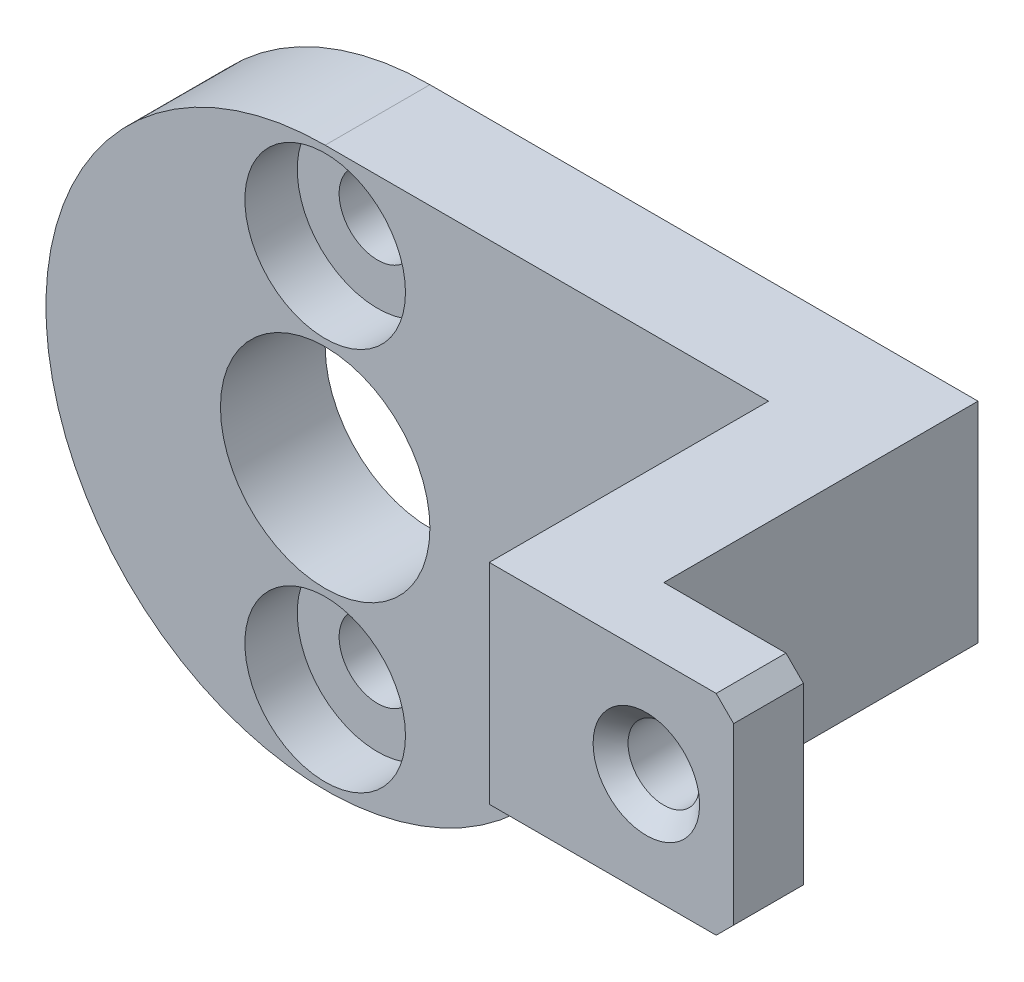
from build123d import *

# Parameters (mm, degrees)
SKETCH_1_W                = 14.3
SKETCH_1_H                = 16
EXTRUDE_1_DEPTH           = 1
SKETCH_3_R                = 3
CUT_EXTRUDE_3_DEPTH       = 10
SKETCH_4_R                = 1.25
CUT_EXTRUDE_4_DEPTH       = 2
CHAMFER_2_SIZE            = 3
SKETCH1_W                 = 2
SKETCH1_H                 = 16
EXTRUDE1_DEPTH            = 8
SKETCH2_W                 = 2
SKETCH2_H                 = 16
EXTRUDE2_DEPTH            = 10
SKETCH3_W                 = 14.3
SKETCH3_H                 = 10
EXTRUDE3_DEPTH            = 10
HOLE_WIZARD_M2_5_2_D      = 2.05
HOLE_WIZARD_M2_5_2_DEPTH  = 7.25
HOLE_WIZARD_M2_5_2_TIP    = 0.615882135
CHAMFER1_SIZE             = 3
CHAMFER4_SIZE             = 0.5
EXTRUDE4_DEPTH            = 6
SKETCH7_W                 = 2
SKETCH7_H                 = 6
EXTRUDE5_DEPTH            = 10
CHAMFER5_SIZE             = 0.5
EXTRUDE6_START            = -2
SKETCH8_W                 = 16
SKETCH8_H                 = 16
SKETCH8_R                 = 3
EXTRUDE6_DEPTH            = 2
SKETCH9_R                 = 1.1
EXTRUDE7_DEPTH            = 21.545619971
SKETCH12_W                = 6
SKETCH12_H                = 6
EXTRUDE10_DEPTH           = 0.5
SKETCH13_W                = 8
SKETCH13_H                = 6
EXTRUDE11_DEPTH           = 0.5
SKETCH15_R                = 1.1
SKETCH15_R_2              = 3
EXTRUDE13_DEPTH           = 1
CUT_EXTRUDE_1_DEPTH       = 10
HOLE_WIZARD_1_D           = 2.2
HOLE_WIZARD_1_CBORE_D     = 4.6
HOLE_WIZARD_1_CBORE_DEPTH = 1.5
FILLET_3_R                = 1
SKETCH_12_W               = 8.120884579
SKETCH_12_H               = 6.489865184
CUT_EXTRUDE_2_DEPTH       = 10


with BuildPart() as part:
    # 草图1 → 拉伸1 (new, symmetric)
    with BuildSketch(Plane.XY):
        Rectangle(SKETCH_1_W, SKETCH_1_H)
    extrude(amount=EXTRUDE_1_DEPTH, both=True)

    # 草图3 → 拉伸3 (cut)
    with BuildSketch(Plane(origin=(0, 0, -1), x_dir=(-1, 0, 0), z_dir=(0, 0, -1))):
        with Locations((2.55, 0)):
            Circle(SKETCH_3_R)
    extrude(amount=-CUT_EXTRUDE_3_DEPTH, mode=Mode.SUBTRACT)

    # 草图4 → 拉伸4 (cut)
    with BuildSketch(Plane(origin=(0, 0, -1), x_dir=(-1, 0, 0), z_dir=(0, 0, -1))):
        with Locations((2.55, 5)):
            Circle(SKETCH_4_R)
        with Locations((2.55, -5)):
            Circle(SKETCH_4_R)
    extrude(amount=-CUT_EXTRUDE_4_DEPTH, mode=Mode.SUBTRACT)

    # 倒角2
    chamfer_2_edges = [part.edges().sort_by_distance(p)[0] for p in [
        (-7.15, 8, 0),
        (-7.15, -8, 0),
    ]]
    chamfer(chamfer_2_edges, length=CHAMFER_2_SIZE)

    # Sketch1 → Extrude1 (add)
    with BuildSketch(Plane.XY.offset(1)):
        with Locations((6.15, 0)):
            Rectangle(SKETCH1_W, SKETCH1_H)
    extrude(amount=EXTRUDE1_DEPTH)

    # Sketch2 → Extrude2 (add)
    with BuildSketch(Plane(origin=(7.15, 0, 0), x_dir=(0, 0, -1), z_dir=(1, 0, 0))):
        with Locations((-8, 0)):
            Rectangle(SKETCH2_W, SKETCH2_H)
    extrude(amount=EXTRUDE2_DEPTH)

    # Sketch3 → Extrude3 (cut)
    with BuildSketch(Plane.XZ.offset(8)):
        with Locations((10, 4)):
            Rectangle(SKETCH3_W, SKETCH3_H)
    extrude(amount=-EXTRUDE3_DEPTH, mode=Mode.SUBTRACT)

    # M2.5 螺纹孔2
    with Locations(Plane(origin=(14.65, 5, 9), x_dir=(1, 0, 0), z_dir=(0, 0, 1))):
        with Locations((0, 0)):
            Hole(HOLE_WIZARD_M2_5_2_D / 2, depth=HOLE_WIZARD_M2_5_2_DEPTH)
            with Locations((0, 0, -(HOLE_WIZARD_M2_5_2_DEPTH + HOLE_WIZARD_M2_5_2_TIP / 2))):  # 118° drill point
                Cone(0, HOLE_WIZARD_M2_5_2_D / 2, HOLE_WIZARD_M2_5_2_TIP, mode=Mode.SUBTRACT)

    # Chamfer1
    chamfer1_edges = [part.edges().sort_by_distance(p)[0] for p in [
        (2.85, -8, 0),
    ]]
    chamfer(chamfer1_edges, length=CHAMFER1_SIZE)

    # Chamfer4
    chamfer4_edges = [part.edges().sort_by_distance(p)[0] for p in [
        (15.675, 5, 9),
    ]]
    chamfer(chamfer4_edges, length=CHAMFER4_SIZE)

    # Sketch6 → Extrude4 (add)
    with BuildSketch(Plane(origin=(0, 8, 0), x_dir=(-1, 0, 0), z_dir=(0, 1, 0))):
        Polygon((-10.65, 7), (-12.65, 7), (-12.65, -1), (-7.15, -1), (-5.15, 1), (-10.65, 1), align=None)
    extrude(amount=-EXTRUDE4_DEPTH)

    # Sketch7 → Extrude5 (cut)
    with BuildSketch(Plane.XZ.offset(-2)):
        with Locations((6.15, 4)):
            Rectangle(SKETCH7_W, SKETCH7_H)
    extrude(amount=-EXTRUDE5_DEPTH, mode=Mode.SUBTRACT)

    # Chamfer5
    chamfer5_edges = [part.edges().sort_by_distance(p)[0] for p in [
        (17.15, 8, 8),
        (17.15, 2, 8),
        (5.15, 2, 8),
        (5.15, 8, 8),
    ]]
    chamfer(chamfer5_edges, length=CHAMFER5_SIZE)

    # Sketch8 → Extrude6 (add)
    with BuildSketch(Plane.XY.offset(1).offset(EXTRUDE6_START)):
        with Locations((-2.55, 0)):
            Rectangle(SKETCH8_W, SKETCH8_H)
        with Locations(Location((-2.55, 0, 0), (0, 0, 180))):
            Circle(SKETCH8_R, mode=Mode.SUBTRACT)
    extrude(amount=EXTRUDE6_DEPTH)

    # Sketch9 → Extrude7 (cut, through all)
    with BuildSketch(Plane.XY.offset(1)):
        with Locations((-2.55, -5.5)):
            Circle(SKETCH9_R)
        with Locations((-2.55, 5.5)):
            Circle(SKETCH9_R)
    extrude(amount=-EXTRUDE7_DEPTH, mode=Mode.SUBTRACT)

    # Sketch12 → Extrude10 (add)
    with BuildSketch(Plane.ZY.offset(-10.65)):
        with Locations((4, 5)):
            Rectangle(SKETCH12_W, SKETCH12_H)
    extrude(amount=EXTRUDE10_DEPTH)

    # Sketch13 → Extrude11 (add)
    with BuildSketch(Plane(origin=(12.65, 0, 0), x_dir=(0, 0, -1), z_dir=(1, 0, 0))):
        with Locations((-3, 5)):
            Rectangle(SKETCH13_W, SKETCH13_H)
    extrude(amount=EXTRUDE11_DEPTH)

    # Sketch15 → Extrude13 (add)
    with BuildSketch(Plane(origin=(0, 0, -1), x_dir=(-1, 0, 0), z_dir=(0, 0, -1))):
        Polygon((10.55, -8), (10.55, 8), (-13.15, 8), (-13.15, 2), (-5.45, 2), (-5.45, -8), align=None)
        with Locations(Location((2.55, 5.5, 0), (0, 0, 180))):
            Circle(SKETCH15_R, mode=Mode.SUBTRACT)
        with Locations(Location((2.55, -5.5, 0), (0, 0, 180))):
            Circle(SKETCH15_R, mode=Mode.SUBTRACT)
        with Locations((2.55, 0)):
            Circle(SKETCH15_R_2, mode=Mode.SUBTRACT)
    extrude(amount=EXTRUDE13_DEPTH)

    # 草图9 → 切除-拉伸1 (cut)
    with BuildSketch(Plane(origin=(0, 0, -2), x_dir=(-1, 0, 0), z_dir=(0, 0, -1))):
        with BuildLine():
            Line((-5.45, 0), (-5.45, -9.75102195))
            Line((-5.45, -9.75102195), (10.872695199, -9.75102195))
            Line((10.872695199, -9.75102195), (10.872695199, 8))
            Line((10.872695199, 8), (10.55, 8))
            Line((10.55, 8), (2.55, 8))
            ThreePointArc((2.55, 8), (8.206854249, -5.656854249), (-5.45, 0))
        make_face()
    extrude(amount=-CUT_EXTRUDE_1_DEPTH, mode=Mode.SUBTRACT)

    # 打孔尺寸(%根据)内六角圆柱头螺钉的类型1 (through all)
    with Locations(Plane.XY.offset(1)):
        with Locations((-2.55, 5.5), (-2.55, -5.5)):
            CounterBoreHole(HOLE_WIZARD_1_D / 2, HOLE_WIZARD_1_CBORE_D / 2, HOLE_WIZARD_1_CBORE_DEPTH)

    # 圆角3
    fillet_3_edges = [part.edges().sort_by_distance(p)[0] for p in [
        (5.45, 2, -0.5),
    ]]
    fillet(fillet_3_edges, radius=FILLET_3_R)

    # 草图12 → 切除-拉伸2 (cut)
    with BuildSketch(Plane(origin=(0, 8, 0), x_dir=(1, 0, 0), z_dir=(0, 1, 0))):
        with Locations((6.089557711, -7.244932592)):
            Rectangle(SKETCH_12_W, SKETCH_12_H)
    extrude(amount=-CUT_EXTRUDE_2_DEPTH, mode=Mode.SUBTRACT)


solid = part.part
